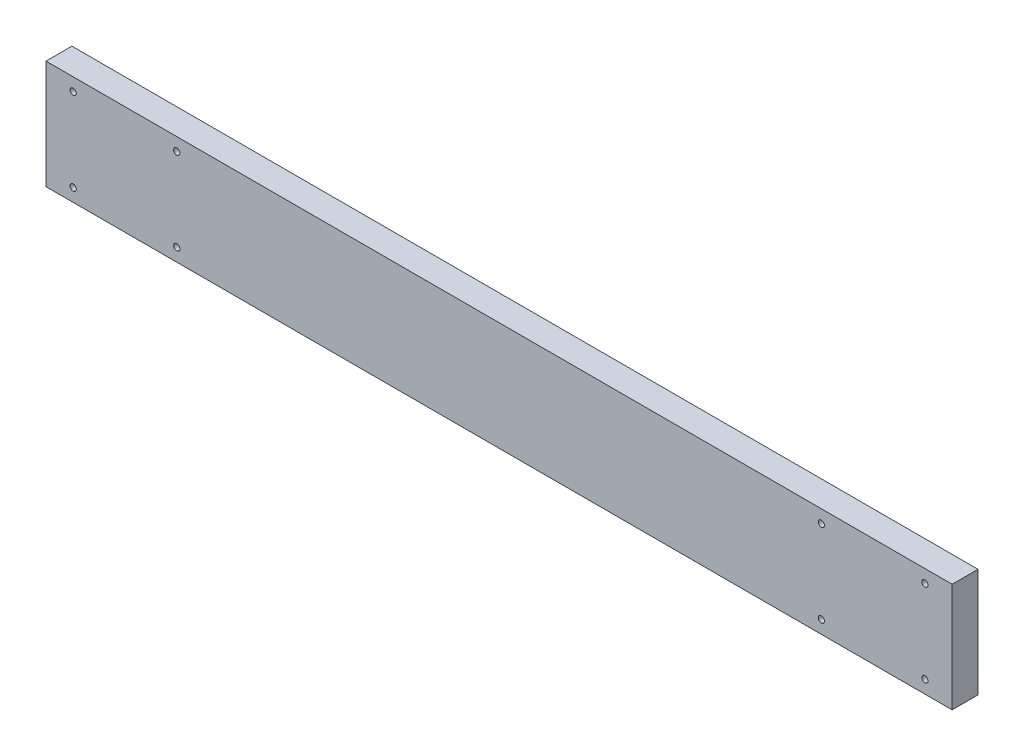
from build123d import *

# Parameters (mm, degrees)
SKETCH1_W            = 350
SKETCH1_H            = 42.02
BOSS_EXTRUDE1_DEPTH  = 10
M2_CLEARANCE_HOLE1_D = 2.4


with BuildPart() as part:
    # Sketch1 → Boss-Extrude1 (new body)
    with BuildSketch(Plane.XY):
        Rectangle(SKETCH1_W, SKETCH1_H)
    extrude(amount=BOSS_EXTRUDE1_DEPTH)

    # M2 Clearance Hole1 (through all)
    with Locations(Plane.XY.offset(10)):
        with Locations((-164.5, 16.01), (-124.5, 16.01), (-124.5, -16.01), (-164.5, -16.01), (164.5, -16.01), (124.5, -16.01), (124.5, 16.01), (164.5, 16.01)):
            Hole(M2_CLEARANCE_HOLE1_D / 2)


solid = part.part
